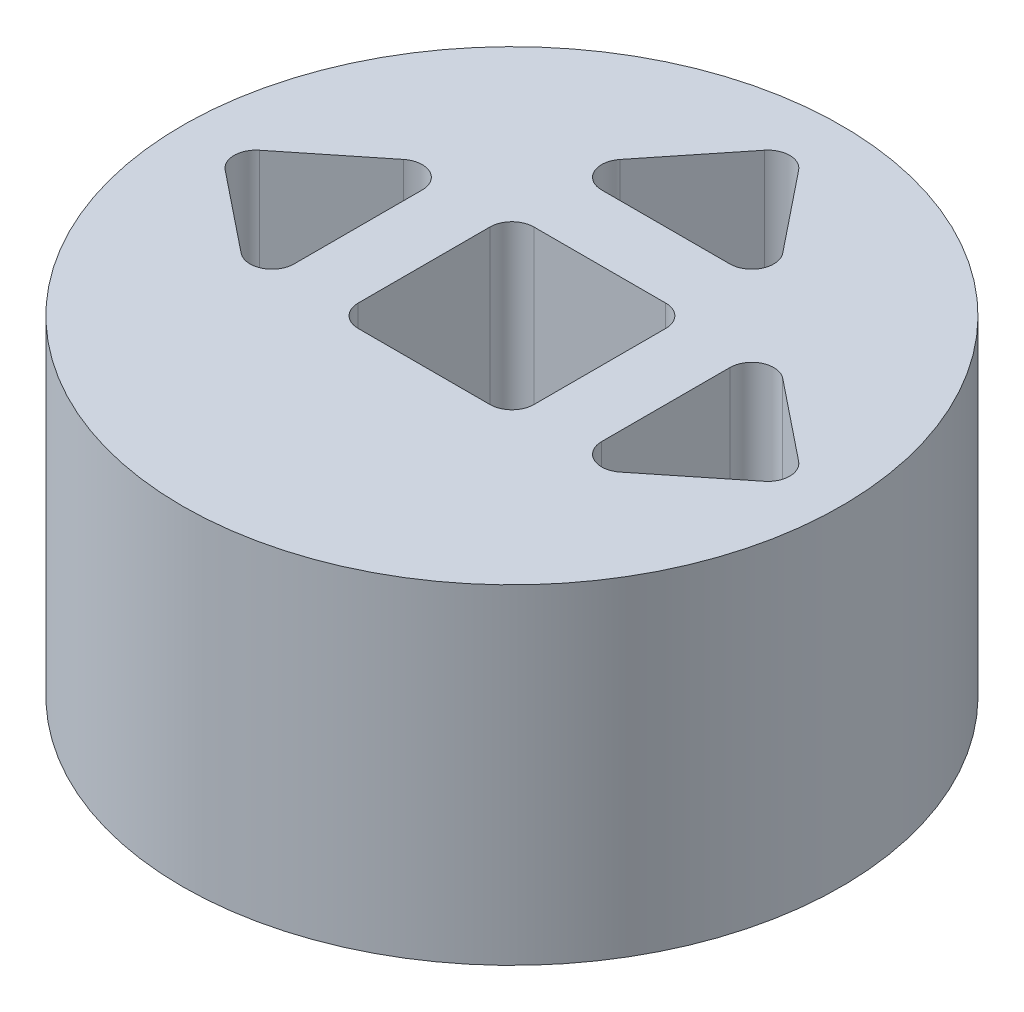
from build123d import *

# Parameters (mm, degrees)
SKETCH1_R           = 15
BOSS_EXTRUDE1_DEPTH = 15
CUT_EXTRUDE1_DEPTH  = 15


with BuildPart() as part:
    # Sketch1 → Boss-Extrude1 (new body)
    with BuildSketch(Plane(origin=(0, 0, 0), x_dir=(1, 0, 0), z_dir=(0, 1, 0))):
        with Locations(Location((0, 0, 0), (0, 0, 270))):
            Circle(SKETCH1_R)
    extrude(amount=BOSS_EXTRUDE1_DEPTH)

    # Sketch2 → Cut-Extrude1 (cut)
    with BuildSketch(Plane(origin=(0, 15, 0), x_dir=(1, 0, 0), z_dir=(0, 1, 0))):
        with BuildLine():
            Line((-0.78062475, 12.269997998), (-3.69895875, 8.625))
            ThreePointArc((-3.69895875, 8.625), (-3.819721819, 7.566987298), (-2.918334001, 7))
            Line((-2.918334001, 7), (2.918334001, 7))
            ThreePointArc((2.918334001, 7), (3.819721819, 7.566987298), (3.69895875, 8.625))
            Line((3.69895875, 8.625), (0.78062475, 12.269997998))
            ThreePointArc((0.78062475, 12.269997998), (0, 12.644997998), (-0.78062475, 12.269997998))
        make_face()
        with BuildLine():
            Line((8.625, -3.69895875), (12.269997998, -0.78062475))
            ThreePointArc((12.269997998, -0.78062475), (12.644997998, 0), (12.269997998, 0.78062475))
            Line((12.269997998, 0.78062475), (8.625, 3.69895875))
            ThreePointArc((8.625, 3.69895875), (7.566987298, 3.819721819), (7, 2.918334001))
            Line((7, 2.918334001), (7, -2.918334001))
            ThreePointArc((7, -2.918334001), (7.566987298, -3.819721819), (8.625, -3.69895875))
        make_face()
        with BuildLine():
            Line((-3, -4), (3, -4))
            ThreePointArc((3, -4), (3.707106781, -3.707106781), (4, -3))
            Line((4, -3), (4, 3))
            ThreePointArc((4, 3), (3.707106781, 3.707106781), (3, 4))
            Line((3, 4), (-3, 4))
            ThreePointArc((-3, 4), (-3.707106781, 3.707106781), (-4, 3))
            Line((-4, 3), (-4, -3))
            ThreePointArc((-4, -3), (-3.707106781, -3.707106781), (-3, -4))
        make_face()
        with BuildLine():
            Line((-8.625, 3.69895875), (-12.269997998, 0.78062475))
            ThreePointArc((-12.269997998, 0.78062475), (-12.644997998, 0), (-12.269997998, -0.78062475))
            Line((-12.269997998, -0.78062475), (-8.625, -3.69895875))
            ThreePointArc((-8.625, -3.69895875), (-7.566987298, -3.819721819), (-7, -2.918334001))
            Line((-7, -2.918334001), (-7, 2.918334001))
            ThreePointArc((-7, 2.918334001), (-7.566987298, 3.819721819), (-8.625, 3.69895875))
        make_face()
    extrude(amount=-CUT_EXTRUDE1_DEPTH, mode=Mode.SUBTRACT)


solid = part.part
